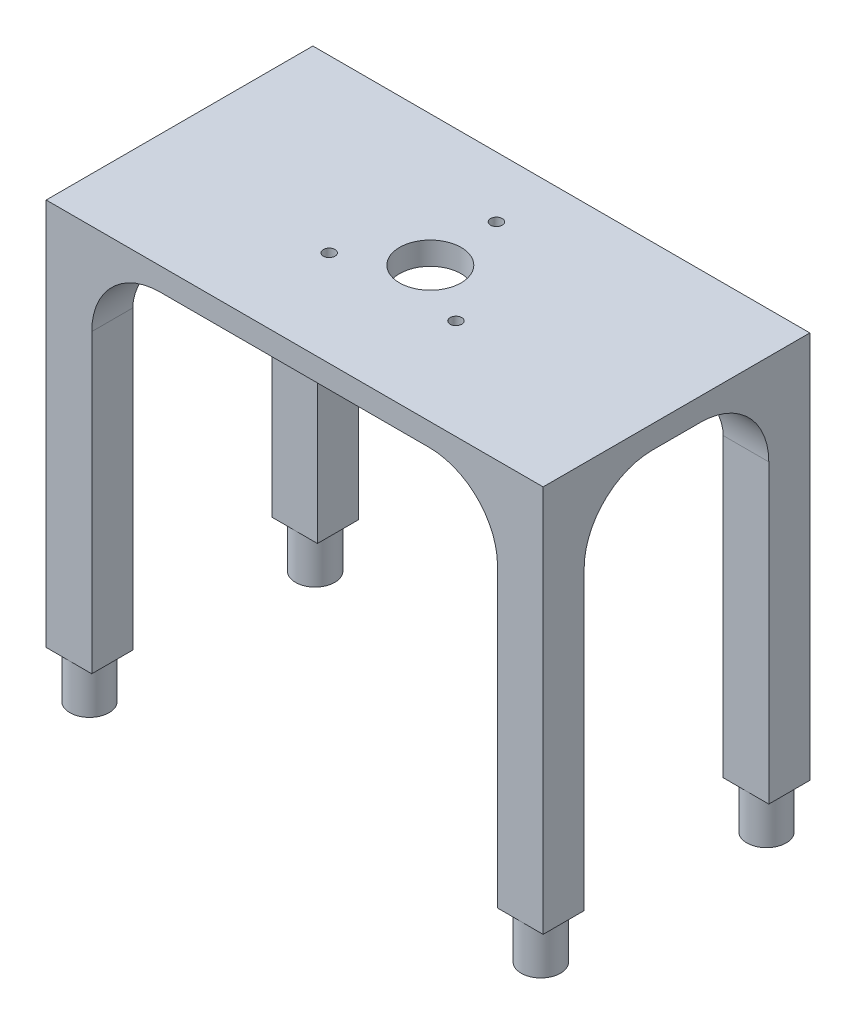
from build123d import *

# Parameters (mm, degrees)
SKETCH1_R             = 4.3
BOSS_EXTRUDE1_DEPTH   = 10
BOSS_EXTRUDE1_2_DEPTH = 10
BOSS_EXTRUDE1_3_DEPTH = 10
BOSS_EXTRUDE1_4_DEPTH = 10
SKETCH2_W             = 10
SKETCH2_H             = 9
BOSS_EXTRUDE2_DEPTH   = 80
SKETCH3_W             = 109
SKETCH3_H             = 58.5
BOSS_EXTRUDE3_DEPTH   = 5
FILLET1_R             = 15
SKETCH4_R             = 1.275
SKETCH4_R_2           = 6.75
CUT_EXTRUDE1_DEPTH    = 5


with BuildPart() as part:
    # Sketch1 → Boss-Extrude1 (new body)
    with BuildSketch(Plane(origin=(0, 0, 0), x_dir=(1, 0, 0), z_dir=(0, 1, 0))):
        with Locations(Location((49.5, 0, 0), (0, 0, 270))):
            Circle(SKETCH1_R)
    extrude(amount=BOSS_EXTRUDE1_DEPTH)



with BuildPart() as body_2:
    # Sketch1 → Boss-Extrude1 2 (new body)
    with BuildSketch(Plane(origin=(0, 0, 0), x_dir=(1, 0, 0), z_dir=(0, 1, 0))):
        with Locations(Location((-49.5, 0, 0), (0, 0, 90))):
            Circle(SKETCH1_R)
    extrude(amount=BOSS_EXTRUDE1_2_DEPTH)


with BuildPart() as body_3:
    # Sketch1 → Boss-Extrude1 3 (new body)
    with BuildSketch(Plane(origin=(0, 0, 0), x_dir=(1, 0, 0), z_dir=(0, 1, 0))):
        with Locations(Location((49.5, 49.5, 0), (0, 0, 270))):
            Circle(SKETCH1_R)
    extrude(amount=BOSS_EXTRUDE1_3_DEPTH)


with BuildPart() as body_4:
    # Sketch1 → Boss-Extrude1 4 (new body)
    with BuildSketch(Plane(origin=(0, 0, 0), x_dir=(1, 0, 0), z_dir=(0, 1, 0))):
        with Locations(Location((-49.5, 49.5, 0), (0, 0, 90))):
            Circle(SKETCH1_R)
    extrude(amount=BOSS_EXTRUDE1_4_DEPTH)


with BuildPart() as part_1:
    add(part.part)

    add(body_2.part)  # Boss-Extrude2 merges body 2

    add(body_3.part)  # Boss-Extrude2 merges body 3

    add(body_4.part)  # Boss-Extrude2 merges body 4
    # Sketch2 → Boss-Extrude2 (add)
    with BuildSketch(Plane(origin=(0, 10, 0), x_dir=(1, 0, 0), z_dir=(0, 1, 0))):
        with Locations((49.5, 0)):
            Rectangle(SKETCH2_W, SKETCH2_H)
        with Locations((-49.5, 0)):
            Rectangle(SKETCH2_W, SKETCH2_H)
        with Locations((49.5, 49.5)):
            Rectangle(SKETCH2_W, SKETCH2_H)
        with Locations((-49.5, 49.5)):
            Rectangle(SKETCH2_W, SKETCH2_H)
    extrude(amount=BOSS_EXTRUDE2_DEPTH)

    # Sketch3 → Boss-Extrude3 (add)
    with BuildSketch(Plane(origin=(0, 90, 0), x_dir=(1, 0, 0), z_dir=(0, 1, 0))):
        with Locations((0, 24.75)):
            Rectangle(SKETCH3_W, SKETCH3_H)
    extrude(amount=BOSS_EXTRUDE3_DEPTH)

    # Fillet1
    fillet1_edges = [part_1.edges().sort_by_distance(p)[0] for p in [
        (49.5, 90, -4.5),
        (44.5, 90, 0),
        (-44.5, 90, 0),
        (-49.5, 90, -4.5),
        (44.5, 90, -49.5),
        (49.5, 90, -45),
        (-44.5, 90, -49.5),
        (-49.5, 90, -45),
    ]]
    fillet(fillet1_edges, radius=FILLET1_R)

    # Sketch4 → Cut-Extrude1 (cut)
    with BuildSketch(Plane(origin=(0, 95, 0), x_dir=(1, 0, 0), z_dir=(0, 1, 0))):
        with Locations(Location((-0.965131435, 40.72196281, 0), (0, 0, 270))):
            Circle(SKETCH4_R)
        with Locations(Location((13.408900265, 17.47196281, 0), (0, 0, 270))):
            Circle(SKETCH4_R)
        with Locations(Location((-13.420367633, 16.50222878, 0), (0, 0, 270))):
            Circle(SKETCH4_R)
        with Locations(Location((0.003026126, 25.25222878, 0), (0, 0, 270))):
            Circle(SKETCH4_R_2)
    extrude(amount=-CUT_EXTRUDE1_DEPTH, mode=Mode.SUBTRACT)


solid = part_1.part
